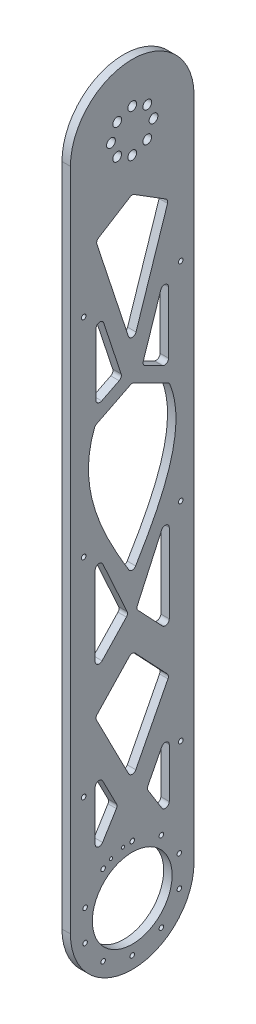
from build123d import *

# Parameters (mm, degrees)
SKETCH1_R                            = 3.3
SKETCH1_R_2                          = 1.7
SKETCH1_R_3                          = 26
BOSS_EXTRUDE1_DEPTH                  = 6.35
CUT_EXTRUDE1_DEPTH                   = 549.511460682
FILLET1_R                            = 3
SKETCH4_R                            = 1.75
CUT_EXTRUDE2_DEPTH                   = 549.511460792
SKETCH5_R                            = 1.2
CUT_EXTRUDE4_DEPTH                   = 549.511460792
BOSS_EXTRUDE2_START                  = -6.35
BOSS_EXTRUDE2_DEPTH                  = 6.35
TAP_DRILL_FOR_M3X0_5_TAP1_AT_2_COUNT = 2
TAP_DRILL_FOR_M3X0_5_TAP1_AT_2_PITCH = 13.03070812
CIRPATTERN1_COUNT                    = 2
CIRPATTERN1_ANGLE                    = 90
CUT_EXTRUDE5_DEPTH                   = 549.511460792
SKETCH10_R                           = 30
CUT_EXTRUDE6_DEPTH                   = 549.511460792


with BuildPart() as part:
    # Sketch1 → Boss-Extrude1 (new body)
    with BuildSketch(Plane(origin=(0, 0, 0), x_dir=(0, -1, 0), z_dir=(1, 0, 0))):
        with BuildLine():
            Line((0, 46.5), (500, 46.5))
            ThreePointArc((500, 46.5), (546.5, 0), (500, -46.5))
            Line((500, -46.5), (0, -46.5))
            ThreePointArc((0, -46.5), (-46.5, 0), (0, 46.5))
        make_face()
        with Locations(Location((-16, 0, 0), (0, 0, 90))):
            Circle(SKETCH1_R, mode=Mode.SUBTRACT)
        with Locations(Location((-11.313708499, 11.313708499, 0), (0, 0, 90))):
            Circle(SKETCH1_R, mode=Mode.SUBTRACT)
        with Locations(Location((0, 16, 0), (0, 0, 90))):
            Circle(SKETCH1_R, mode=Mode.SUBTRACT)
        with Locations(Location((11.313708499, 11.313708499, 0), (0, 0, 90))):
            Circle(SKETCH1_R, mode=Mode.SUBTRACT)
        with Locations(Location((16, 0, 0), (0, 0, 90))):
            Circle(SKETCH1_R, mode=Mode.SUBTRACT)
        with Locations(Location((11.313708499, -11.313708499, 0), (0, 0, 90))):
            Circle(SKETCH1_R, mode=Mode.SUBTRACT)
        with Locations(Location((537.25, 0, 0), (0, 0, 90))):
            Circle(SKETCH1_R_2, mode=Mode.SUBTRACT)
        with Locations(Location((530.13588304, -21.895000648, 0), (0, 0, 90))):
            Circle(SKETCH1_R_2, mode=Mode.SUBTRACT)
        with Locations(Location((511.51088304, -35.426855232, 0), (0, 0, 90))):
            Circle(SKETCH1_R_2, mode=Mode.SUBTRACT)
        with Locations(Location((488.48911696, -35.426855232, 0), (0, 0, 90))):
            Circle(SKETCH1_R_2, mode=Mode.SUBTRACT)
        with Locations(Location((469.86411696, -21.895000648, 0), (0, 0, 90))):
            Circle(SKETCH1_R_2, mode=Mode.SUBTRACT)
        with Locations(Location((462.75, 0, 0), (0, 0, 90))):
            Circle(SKETCH1_R_2, mode=Mode.SUBTRACT)
        with Locations(Location((469.86411696, 21.895000648, 0), (0, 0, 90))):
            Circle(SKETCH1_R_2, mode=Mode.SUBTRACT)
        with Locations(Location((488.48911696, 35.426855232, 0), (0, 0, 90))):
            Circle(SKETCH1_R_2, mode=Mode.SUBTRACT)
        with Locations(Location((511.51088304, 35.426855232, 0), (0, 0, 90))):
            Circle(SKETCH1_R_2, mode=Mode.SUBTRACT)
        with Locations(Location((530.13588304, 21.895000648, 0), (0, 0, 90))):
            Circle(SKETCH1_R_2, mode=Mode.SUBTRACT)
        with Locations(Location((500, 0, 0), (0, 0, 90))):
            Circle(SKETCH1_R_3, mode=Mode.SUBTRACT)
        with Locations(Location((0, -16, 0), (0, 0, 90))):
            Circle(SKETCH1_R, mode=Mode.SUBTRACT)
        with Locations(Location((-11.313708499, -11.313708499, 0), (0, 0, 90))):
            Circle(SKETCH1_R, mode=Mode.SUBTRACT)
    extrude(amount=BOSS_EXTRUDE1_DEPTH)

    # Sketch3 → Cut-Extrude1 (cut, through all)
    with BuildSketch(Plane(origin=(6.35, 0, 0), x_dir=(0, 0, -1), z_dir=(1, 0, 0))):
        Polygon((0, -422.848022722), (27.858212922, -368.632839363), (0, -339.139268075), (-27.858212922, -368.632839363), align=None)
        Polygon((0, -41.368651369), (-27.312924288, -58.435222232), (0, -141.248998295), (27.312924288, -58.435222232), align=None)
        Polygon((3, -313.189087212), (27.858212922, -339.506549748), (27.858212922, -258.646044282), align=None)
        Polygon((-27.858212922, -339.506549748), (-27.858212922, -258.646044282), (-3, -313.189087212), align=None)
        Polygon((-27.858212922, -401.452857349), (-11, -434.260816252), (-27.858212922, -461.481824785), align=None)
        Polygon((11, -434.260816252), (27.858212922, -461.481824785), (27.858212922, -401.452857349), align=None)
        with BuildLine():
            Line((0, -164.248853344), (-27.858212922, -178.200474573))
            add(Edge.make_bspline(
                [(-27.858212922, -178.200474573), (-43.7790539, -216.093343216), (-18.61661693, -258.276071598), (0, -289.085024731)],
                knots=[0, 0, 0, 0, 1, 1, 1, 1], degree=3))
            add(Edge.make_bspline(
                [(27.858212922, -178.200474573), (43.7790539, -216.093343216), (18.61661693, -258.276071598), (0, -289.085024731)],
                knots=[0, 0, 0, 0, 1, 1, 1, 1], degree=3))
            Line((27.858212922, -178.200474573), (0, -164.248853344))
        make_face()
        Polygon((7.5, -156.820958214), (27.312924288, -96.747453897), (27.312924288, -166.743432993), align=None)
        Polygon((-27.312924288, -96.747453897), (-27.312924288, -166.743432993), (-7.5, -156.820958214), align=None)
    extrude(amount=-CUT_EXTRUDE1_DEPTH, mode=Mode.SUBTRACT)

    # Fillet1
    fillet1_edges = [part.edges().sort_by_distance(p)[0] for p in [
        (3.175, -58.435222232, -27.312924288),
        (3.175, -41.368651369, 0),
        (3.175, -58.435222232, 27.312924288),
        (3.175, -141.248998295, 0),
        (3.175, -289.085024731, 0),
        (3.175, -164.248853344, 0),
        (3.175, -401.452857349, 27.858212922),
        (3.175, -434.260816252, 11),
        (3.175, -461.481824785, 27.858212922),
        (3.175, -461.481824785, -27.858212922),
        (3.175, -434.260816252, -11),
        (3.175, -401.452857349, -27.858212922),
        (3.175, -368.632839363, -27.858212922),
        (3.175, -339.139268075, 0),
        (3.175, -368.632839363, 27.858212922),
        (3.175, -422.848022722, 0),
        (3.175, -313.189087212, 3),
        (3.175, -339.506549748, 27.858212922),
        (3.175, -258.646044282, 27.858212922),
        (3.175, -178.200474573, -27.858212922),
        (3.175, -178.200474573, 27.858212922),
        (3.175, -339.506549748, -27.858212922),
        (3.175, -313.189087212, -3),
        (3.175, -258.646044282, -27.858212922),
        (3.175, -96.747453897, 27.312924288),
        (3.175, -166.743432993, 27.312924288),
        (3.175, -156.820958214, 7.5),
        (3.175, -166.743432993, -27.312924288),
        (3.175, -156.820958214, -7.5),
        (3.175, -96.747453897, -27.312924288),
    ]]
    fillet(fillet1_edges, radius=FILLET1_R)

    # Sketch4 → Cut-Extrude2 (cut, through all)
    with BuildSketch(Plane(origin=(6.35, 0, 0), x_dir=(0, 0, -1), z_dir=(1, 0, 0))):
        with Locations((-36.5, -103.175)):
            Circle(SKETCH4_R)
        with Locations(Location((36.5, -103.175, 0), (0, 0, 180))):
            Circle(SKETCH4_R)
        with Locations(Location((-36.5, -259.525, 0), (0, 0, 180))):
            Circle(SKETCH4_R)
        with Locations((36.5, -259.525)):
            Circle(SKETCH4_R)
        with Locations((-36.5, -415.875)):
            Circle(SKETCH4_R)
        with Locations(Location((36.5, -415.875, 0), (0, 0, 180))):
            Circle(SKETCH4_R)
    extrude(amount=-CUT_EXTRUDE2_DEPTH, mode=Mode.SUBTRACT)

    # Sketch5 → Cut-Extrude4 (cut, through all)
    with BuildSketch(Plane(origin=(6.35, 0, 0), x_dir=(0, 0, -1), z_dir=(1, 0, 0))):
        with Locations((-6.916110339, -463.343078174)):
            Circle(SKETCH5_R)
        with Locations((-15.951147244, -466.27873962)):
            Circle(SKETCH5_R)
    extrude(amount=-CUT_EXTRUDE4_DEPTH, mode=Mode.SUBTRACT)

    # Sketch6 → Boss-Extrude2 (add)
    with BuildSketch(Plane(origin=(6.35, 0, 0), x_dir=(0, 0, -1), z_dir=(1, 0, 0)).offset(BOSS_EXTRUDE2_START)):
        with BuildLine():
            Line((-44.110383395, -529.968247771), (-29.968247771, -544.110383395))
            ThreePointArc((-29.968247771, -544.110383395), (-23.286397782, -542.399293624), (-16.474718596, -543.483717035))
            ThreePointArc((-16.474718596, -543.483717035), (-32.880465325, -532.880465325), (-43.483717035, -516.474718596))
            ThreePointArc((-43.483717035, -516.474718596), (-42.399293624, -523.286397782), (-44.110383395, -529.968247771))
        make_face()
    boss_extrude2 = extrude(amount=BOSS_EXTRUDE2_DEPTH)

    # Sketch8 → Tap Drill for M3x0.5 Tap1 (revolve, cut)
    with BuildSketch(Plane(origin=(3.175, -532.796674896, 41.28195627), x_dir=(0, -0.7071067811865424, -0.7071067811865527), z_dir=(1, 0, 0))):
        Polygon((0, 0), (0, 5.751075774), (1.25, 5), (1.25, 0), align=None)
    tap_drill_for_m3x0_5_tap1 = revolve(axis=Axis((3.175, -537.286802956, 45.772084331), (0, 0.7071067811865529, -0.7071067811865422)), mode=Mode.SUBTRACT)

    # Tap Drill for M3x0.5 Tap1 at 2: Tap Drill for M3x0.5 Tap1 ×2
    with Locations(*[Vector(0, -0.7071067811865422, -0.7071067811865529) * (i * TAP_DRILL_FOR_M3X0_5_TAP1_AT_2_PITCH) for i in range(1, TAP_DRILL_FOR_M3X0_5_TAP1_AT_2_COUNT)]):
        add(tap_drill_for_m3x0_5_tap1, mode=Mode.SUBTRACT)

    # CirPattern1: Boss-Extrude2, Tap Drill for M3x0.5 Tap1 ×2 about axis
    cirpattern1_axis = Axis((0, -500, 0), (1, 0, 0))
    add([boss_extrude2.rotate(cirpattern1_axis, i * CIRPATTERN1_ANGLE / (CIRPATTERN1_COUNT - 1)) for i in range(1, CIRPATTERN1_COUNT)])
    add([tap_drill_for_m3x0_5_tap1.rotate(cirpattern1_axis, i * CIRPATTERN1_ANGLE / (CIRPATTERN1_COUNT - 1)) for i in range(1, CIRPATTERN1_COUNT)], mode=Mode.SUBTRACT)

    # CirPattern1 copy 1 sketch → CirPattern1 copy 1 (revolve, cut)
    with BuildSketch(Plane(origin=(3.175, -532.067854195, -42.010776971), x_dir=(0, 0.7071067811865551, -0.7071067811865399), z_dir=(1, 0, 0))):
        Polygon((0, 0), (0, 5.751075774), (1.25, 5), (1.25, 0), align=None)
    revolve(axis=Axis((3.175, -536.557982255, -46.500905032), (0, 0.7071067811865398, 0.7071067811865553)), mode=Mode.SUBTRACT)

    # Sketch9 → Cut-Extrude5 (cut, through all)
    with BuildSketch(Plane(origin=(6.35, 0, 0), x_dir=(0, 0, -1), z_dir=(1, 0, 0))):
        with BuildLine():
            Line((-43.483717035, -516.474718596), (-63.483717035, -516.474718596))
            ThreePointArc((-63.483717035, -516.474718596), (0, -565.586573942), (63.483717035, -516.474718596))
            Line((63.483717035, -516.474718596), (43.483717035, -516.474718596))
            ThreePointArc((43.483717035, -516.474718596), (0, -546.5), (-43.483717035, -516.474718596))
        make_face()
    extrude(amount=-CUT_EXTRUDE5_DEPTH, mode=Mode.SUBTRACT)

    # Sketch10 → Cut-Extrude6 (cut, through all)
    with BuildSketch(Plane(origin=(6.35, 0, 0), x_dir=(0, 0, -1), z_dir=(1, 0, 0))):
        with Locations((0, -500)):
            Circle(SKETCH10_R)
    extrude(amount=-CUT_EXTRUDE6_DEPTH, mode=Mode.SUBTRACT)


solid = part.part
